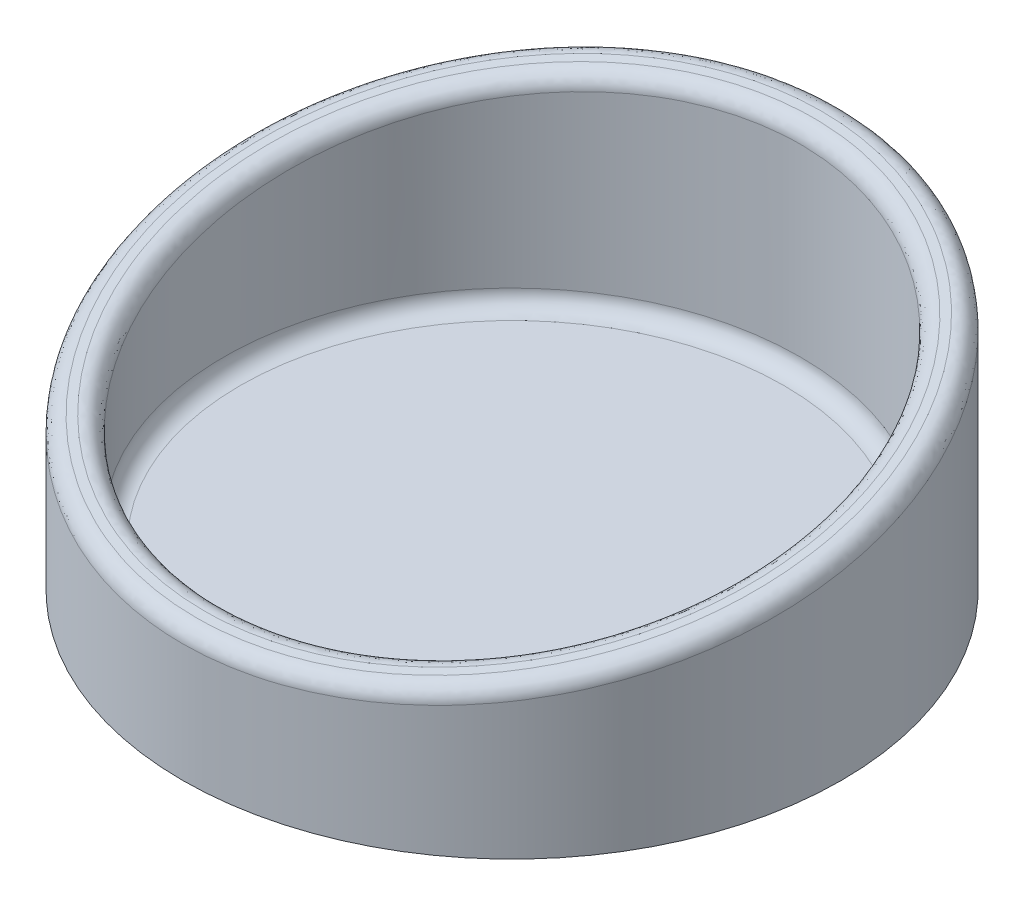
from build123d import *

# Parameters (mm, degrees)
SKETCH1_R               = 25.4
BOSS_EXTRUDE1_DEPTH     = 20.32
SHELL1_T                = -3.175
CUT_EXTRUDE1_DEPTH      = 42.270115096
CUT_EXTRUDE1_DEPTH_BACK = 42.270115096
FILLET1_R               = 1.27


with BuildPart() as part:
    # Sketch1 → Boss-Extrude1 (new body)
    with BuildSketch(Plane(origin=(0, 0, 0), x_dir=(1, 0, 0), z_dir=(0, 1, 0))):
        with Locations(Location((0, 0, 0), (0, 0, 270))):
            Circle(SKETCH1_R)
    extrude(amount=BOSS_EXTRUDE1_DEPTH)

    # Shell1
    shell1_openings = [part.faces().sort_by_distance(p)[0] for p in [
        (0, 20.32, 0),
    ]]
    offset(amount=SHELL1_T, openings=shell1_openings, kind=Kind.INTERSECTION)

    # Sketch2 → Cut-Extrude1 (cut, two sides: drawn at the far end of the back side and taken through both)
    with BuildSketch(Plane(origin=(0, 0, 0), x_dir=(0, 0, -1), z_dir=(1, 0, 0)).offset(-CUT_EXTRUDE1_DEPTH_BACK)):
        Polygon((-25.4, 10.16), (-25.4, 20.32), (25.4, 20.32), align=None)
    extrude(amount=CUT_EXTRUDE1_DEPTH + CUT_EXTRUDE1_DEPTH_BACK, mode=Mode.SUBTRACT)

    # Fillet1
    fillet1_edges = [part.edges().sort_by_distance(p)[0] for p in [
        (-25.4, 15.240000004, -2e-08),
        (3.323e-06, 19.685, -22.225),
        (0, 3.175, -22.225),
    ]]
    fillet(fillet1_edges, radius=FILLET1_R)


solid = part.part
